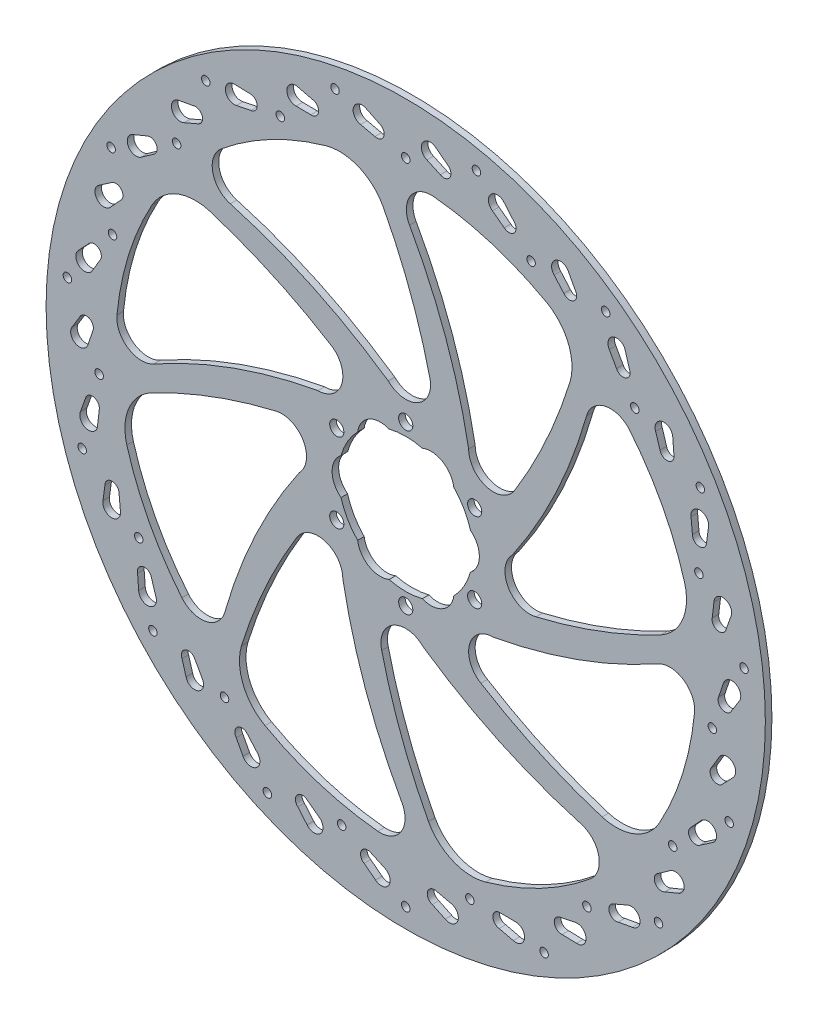
from build123d import *

# Parameters (mm, degrees)
SKETCH1_R      = 101.5
SKETCH1_R_2    = 1.2
SKETCH1_R_3    = 2
EXTRUDE1_DEPTH = 1.85


with BuildPart() as part:
    # Sketch1 → Extrude1 (new body)
    with BuildSketch(Plane.XY):
        Circle(SKETCH1_R)
        with Locations((-71.341909158, -64.236543533)):
            Circle(SKETCH1_R_2, mode=Mode.SUBTRACT)
        with Locations((-51.137316949, -70.384478511)):
            Circle(SKETCH1_R_2, mode=Mode.SUBTRACT)
        with BuildLine():
            Line((-61.998078989, -70.824326541), (-63.14297362, -66.91955058))
            ThreePointArc((-63.14297362, -66.91955058), (-62.141111955, -64.274503661), (-59.496065036, -65.276365326))
            Line((-59.496065036, -65.276365326), (-57.459092502, -68.897958465))
            ThreePointArc((-57.459092502, -68.897958465), (-58.475442576, -72.491803952), (-61.927280322, -71.06579237))
            ThreePointArc((-61.927280322, -71.06579237), (-61.965719597, -70.945950777), (-61.998078989, -70.824326541))
        make_face(mode=Mode.SUBTRACT)
        with BuildLine():
            Line((-75.368477695, -56.38651965), (-75.676505059, -52.329035434))
            ThreePointArc((-75.676505059, -52.329035434), (-74.146600298, -49.950087889), (-71.767652754, -51.47999265))
            Line((-71.767652754, -51.47999265), (-70.528164509, -55.445955693))
            ThreePointArc((-70.528164509, -55.445955693), (-72.269507387, -58.749955971), (-75.349429718, -56.637428741))
            ThreePointArc((-75.349429718, -56.637428741), (-75.362112534, -56.512214001), (-75.368477695, -56.38651965))
        make_face(mode=Mode.SUBTRACT)
        with Locations((-39.046720971, -87.700371201)):
            Circle(SKETCH1_R_2, mode=Mode.SUBTRACT)
        with BuildLine():
            Line((-45.918066731, -82.16677051), (-47.84979124, -78.585360251))
            ThreePointArc((-47.84979124, -78.585360251), (-47.419758833, -75.7898152), (-44.624213783, -76.219847607))
            Line((-44.624213783, -76.219847607), (-41.878782433, -79.338789842))
            ThreePointArc((-41.878782433, -79.338789842), (-42.125720327, -83.065412245), (-45.798611616, -82.38823986))
            ThreePointArc((-45.798611616, -82.38823986), (-45.861127369, -82.279009069), (-45.918066731, -82.16677051))
        make_face(mode=Mode.SUBTRACT)
        with BuildLine():
            Line((-27.831214617, -89.918132327), (-30.465343373, -86.816612584))
            ThreePointArc((-30.465343373, -86.816612584), (-30.625934705, -83.992748135), (-27.802070256, -83.832156804))
            Line((-27.802070256, -83.832156804), (-24.468168615, -86.312135394))
            ThreePointArc((-24.468168615, -86.312135394), (-23.934901959, -90.008663432), (-27.668323816, -90.109925926))
            ThreePointArc((-27.668323816, -90.109925926), (-27.752183808, -90.016079845), (-27.831214617, -89.918132327))
        make_face(mode=Mode.SUBTRACT)
        with Locations((0, -96.000007955)):
            Circle(SKETCH1_R_2, mode=Mode.SUBTRACT)
        with BuildLine():
            Line((-8.528004876, -93.739640287), (-11.749413813, -91.253562355))
            ThreePointArc((-11.749413813, -91.253562355), (-12.49361027, -88.524794935), (-9.764842851, -87.780598478))
            Line((-9.764842851, -87.780598478), (-5.988178417, -89.513226458))
            ThreePointArc((-5.988178417, -89.513226458), (-4.698013522, -93.018104117), (-8.328797499, -93.893375834))
            ThreePointArc((-8.328797499, -93.893375834), (-8.430336646, -93.819015988), (-8.528004876, -93.739640287))
        make_face(mode=Mode.SUBTRACT)
        with Locations((-18.088317101, -85.098841264)):
            Circle(SKETCH1_R_2, mode=Mode.SUBTRACT)
        with Locations((-91.30143313, -29.665633918)):
            Circle(SKETCH1_R_2, mode=Mode.SUBTRACT)
        with BuildLine():
            Line((-85.444912268, -39.484351277), (-84.902610092, -35.451490336))
            ThreePointArc((-84.902610092, -35.451490336), (-82.911526414, -33.442613588), (-80.902649666, -35.433697266))
            Line((-80.902649666, -35.433697266), (-80.514817296, -39.570698598))
            ThreePointArc((-80.514817296, -39.570698598), (-82.905047939, -42.440453001), (-85.478447469, -39.7337377))
            ThreePointArc((-85.478447469, -39.7337377), (-85.464819526, -39.608622296), (-85.444912268, -39.484351277))
        make_face(mode=Mode.SUBTRACT)
        with Locations((-75.344210129, -43.5)):
            Circle(SKETCH1_R_2, mode=Mode.SUBTRACT)
        with BuildLine():
            Line((-91.786994165, -20.856527287), (-90.418063655, -17.024544996))
            ThreePointArc((-90.418063655, -17.024544996), (-88.052820971, -15.473536599), (-86.501812575, -17.838779282))
            Line((-86.501812575, -17.838779282), (-86.982586214, -21.966012093))
            ThreePointArc((-86.982586214, -21.966012093), (-89.917240072, -24.276098583), (-91.871646894, -21.093491658))
            ThreePointArc((-91.871646894, -21.093491658), (-91.832303799, -20.973943734), (-91.786994165, -20.856527287))
        make_face(mode=Mode.SUBTRACT)
        with BuildLine():
            Line((-94.117543974, -1.317172973), (-91.981813962, 2.146454654))
            ThreePointArc((-91.981813962, 2.146454654), (-89.345784728, 3.17180819), (-88.320431192, 0.535778956))
            Line((-88.320431192, 0.535778956), (-89.648798725, -3.401305455))
            ThreePointArc((-89.648798725, -3.401305455), (-92.999617344, -5.050762167), (-94.2496145, -1.531358813))
            ThreePointArc((-94.2496145, -1.531358813), (-94.186275736, -1.422603187), (-94.117543974, -1.317172973))
        make_face(mode=Mode.SUBTRACT)
        with Locations((-86.523404897, -9.093976304)):
            Circle(SKETCH1_R_2, mode=Mode.SUBTRACT)
        with BuildLine():
            ThreePointArc((-51.044949255, -49.522858535), (-56.342570087, -54.471101417), (-63.183389209, -52.072541881))
            ThreePointArc((-63.183389209, -52.072541881), (-72.466897056, -38.108255286), (-78.710796809, -22.545526287))
            ThreePointArc((-78.710796809, -22.545526287), (-78.170211393, -13.29412178), (-71.969304687, -6.407215801))
            ThreePointArc((-71.969304687, -6.407215801), (-54.777609064, 1.292105638), (-36.75649861, 6.776039177))
            ThreePointArc((-36.75649861, 6.776039177), (-28.923584542, 3.475240148), (-30.050244577, -4.949749715))
            ThreePointArc((-30.050244577, -4.949749715), (-42.39020698, -26.368402936), (-51.044949255, -49.522858535))
        make_face(mode=Mode.SUBTRACT)
        with BuildLine():
            ThreePointArc((-30.782152671, -21.199386168), (-22.909428641, -17.99469689), (-17.748730128, -24.748733305))
            ThreePointArc((-17.748730128, -24.748733305), (-11.329126286, -48.619679336), (-1.07628067, -71.112178857))
            ThreePointArc((-1.07628067, -71.112178857), (-1.323328187, -78.357098569), (-7.85655549, -81.498250445))
            ThreePointArc((-7.85655549, -81.498250445), (-24.295228587, -78.188440052), (-39.714843653, -71.599032699))
            ThreePointArc((-39.714843653, -71.599032699), (-45.874322902, -64.675050223), (-46.359397641, -55.420569123))
            ThreePointArc((-46.359397641, -55.420569123), (-39.647275485, -37.819962167), (-30.782152671, -21.199386168))
        make_face(mode=Mode.SUBTRACT)
        with Locations((-19.459967777, -11.235217635)):
            Circle(SKETCH1_R_3, mode=Mode.SUBTRACT)
        with BuildLine():
            Line((11.1479196, -93.464276153), (7.480021511, -91.702293568))
            ThreePointArc((7.480021511, -91.702293568), (6.184744884, -89.187883407), (8.699155045, -87.892606779))
            Line((8.699155045, -87.892606779), (12.753523912, -88.802159994))
            ThreePointArc((12.753523912, -88.802159994), (14.744200648, -91.962207302), (11.374737236, -93.573234667))
            ThreePointArc((11.374737236, -93.573234667), (11.259956682, -93.521610938), (11.1479196, -93.464276153))
        make_face(mode=Mode.SUBTRACT)
        with Locations((18.088317101, -85.098841264)):
            Circle(SKETCH1_R_2, mode=Mode.SUBTRACT)
        with BuildLine():
            Line((30.336626496, -89.104074661), (26.382544002, -88.143194515))
            ThreePointArc((26.382544002, -88.143194515), (24.592797009, -85.953033403), (26.782958121, -84.16328641))
            Line((26.782958121, -84.16328641), (30.937836048, -84.210013017))
            ThreePointArc((30.937836048, -84.210013017), (33.5420225, -86.887120744), (30.581141371, -89.163494131))
            ThreePointArc((30.581141371, -89.163494131), (30.45813587, -89.136862723), (30.336626496, -89.104074661))
        make_face(mode=Mode.SUBTRACT)
        with Locations((39.046720971, -87.700371201)):
            Circle(SKETCH1_R_2, mode=Mode.SUBTRACT)
        with BuildLine():
            Line((48.199477243, -80.849597536), (44.132022723, -80.731814905))
            ThreePointArc((44.132022723, -80.731814905), (41.926025895, -78.961623391), (43.696217409, -76.755626563))
            Line((43.696217409, -76.755626563), (47.770016293, -75.937484388))
            ThreePointArc((47.770016293, -75.937484388), (50.873897017, -78.014650079), (48.451002884, -80.856881048))
            ThreePointArc((48.451002884, -80.856881048), (48.325148368, -80.856405882), (48.199477243, -80.849597536))
        make_face(mode=Mode.SUBTRACT)
        with BuildLine():
            ThreePointArc((-6.776039177, -36.756506565), (-3.475240148, -28.923592497), (4.949749715, -30.050252532))
            ThreePointArc((4.949749715, -30.050252532), (26.368402936, -42.390214935), (49.522858535, -51.04495721))
            ThreePointArc((49.522858535, -51.04495721), (54.471101417, -56.342578042), (52.072541881, -63.183397164))
            ThreePointArc((52.072541881, -63.183397164), (38.108255286, -72.466905011), (22.545526287, -78.710804764))
            ThreePointArc((22.545526287, -78.710804764), (13.29412178, -78.170219348), (6.4072158, -71.969312642))
            ThreePointArc((6.4072158, -71.969312642), (-1.292105638, -54.777617018), (-6.776039177, -36.756506565))
        make_face(mode=Mode.SUBTRACT)
        with Locations((51.137316949, -70.384478511)):
            Circle(SKETCH1_R_2, mode=Mode.SUBTRACT)
        with BuildLine():
            Line((63.955779547, -69.06160504), (59.952720281, -69.792067588))
            ThreePointArc((59.952720281, -69.792067588), (57.426886267, -68.519211537), (58.699742318, -65.993377522))
            Line((58.699742318, -65.993377522), (62.514417599, -64.346123302))
            ThreePointArc((62.514417599, -64.346123302), (65.982338113, -65.73256485), (64.203323077, -69.016434268))
            ThreePointArc((64.203323077, -69.016434268), (64.080119991, -69.042136111), (63.955779547, -69.06160504))
        make_face(mode=Mode.SUBTRACT)
        with Locations((71.341909157, -64.236543533)):
            Circle(SKETCH1_R_2, mode=Mode.SUBTRACT)
        with BuildLine():
            Line((76.916907392, -54.25528901), (73.153196279, -55.802072019))
            ThreePointArc((73.153196279, -55.802072019), (70.417916143, -55.082181347), (71.137806816, -52.346901211))
            Line((71.137806816, -52.346901211), (74.526638879, -49.94252786))
            ThreePointArc((74.526638879, -49.94252786), (78.207034416, -50.577651116), (77.14964997, -54.159638134))
            ThreePointArc((77.14964997, -54.159638134), (77.034482881, -54.210393691), (76.916907392, -54.25528901))
        make_face(mode=Mode.SUBTRACT)
        with Locations((0, -22.470435269)):
            Circle(SKETCH1_R_3, mode=Mode.SUBTRACT)
        with Locations((19.459967777, -11.235217635)):
            Circle(SKETCH1_R_3, mode=Mode.SUBTRACT)
        with BuildLine():
            ThreePointArc((71.599032699, -39.714843653), (64.675050223, -45.874322902), (55.420569123, -46.359397641))
            ThreePointArc((55.420569123, -46.359397641), (37.819962167, -39.647275485), (21.199386168, -30.782152671))
            ThreePointArc((21.199386168, -30.782152671), (17.99469689, -22.909428641), (24.748733305, -17.748730128))
            ThreePointArc((24.748733305, -17.748730128), (48.619679336, -11.329126286), (71.112178857, -1.07628067))
            ThreePointArc((71.112178857, -1.07628067), (78.357098569, -1.323328187), (81.498250445, -7.85655549))
            ThreePointArc((81.498250445, -7.85655549), (78.188440052, -24.295228587), (71.599032699, -39.714843653))
        make_face(mode=Mode.SUBTRACT)
        with Locations((75.344210129, -43.5)):
            Circle(SKETCH1_R_2, mode=Mode.SUBTRACT)
        with BuildLine():
            Line((86.516397295, -37.077756504), (83.156526571, -39.373258134))
            ThreePointArc((83.156526571, -39.373258134), (80.331345182, -39.237795518), (80.466807798, -36.41261413))
            Line((80.466807798, -36.41261413), (83.281688422, -33.356204301))
            ThreePointArc((83.281688422, -33.356204301), (87.013708036, -33.212251331), (86.724166954, -36.935805926))
            ThreePointArc((86.724166954, -36.935805926), (86.622069216, -37.009396937), (86.516397295, -37.077756504))
        make_face(mode=Mode.SUBTRACT)
        with Locations((91.30143313, -29.665633918)):
            Circle(SKETCH1_R_2, mode=Mode.SUBTRACT)
        with BuildLine():
            Line((92.334705485, -18.27974812), (89.525517622, -21.223643935))
            ThreePointArc((89.525517622, -21.223643935), (86.733908964, -21.678529742), (86.279023157, -18.886921083))
            Line((86.279023157, -18.886921083), (88.39692855, -15.312054553))
            ThreePointArc((88.39692855, -15.312054553), (92.017465076, -14.395316792), (92.508421694, -18.097701761))
            ThreePointArc((92.508421694, -18.097701761), (92.423855467, -18.190911946), (92.334705485, -18.27974812))
        make_face(mode=Mode.SUBTRACT)
        with Locations((86.523404897, -9.093976304)):
            Circle(SKETCH1_R_2, mode=Mode.SUBTRACT)
        with Locations((-95.474109867, 10.034733305)):
            Circle(SKETCH1_R_2, mode=Mode.SUBTRACT)
        with BuildLine():
            Line((-92.334705485, 18.27974812), (-89.525517622, 21.223643935))
            ThreePointArc((-89.525517622, 21.223643935), (-86.733908964, 21.678529742), (-86.279023157, 18.886921083))
            Line((-86.279023157, 18.886921083), (-88.39692855, 15.312054553))
            ThreePointArc((-88.39692855, 15.312054553), (-92.017465076, 14.395316792), (-92.508421694, 18.097701761))
            ThreePointArc((-92.508421694, 18.097701761), (-92.423855467, 18.190911946), (-92.334705485, 18.27974812))
        make_face(mode=Mode.SUBTRACT)
        with Locations((-82.741916918, 26.884478511)):
            Circle(SKETCH1_R_2, mode=Mode.SUBTRACT)
        with BuildLine():
            Line((-86.516397295, 37.077756504), (-83.156526571, 39.373258134))
            ThreePointArc((-83.156526571, 39.373258134), (-80.331345182, 39.237795518), (-80.466807798, 36.41261413))
            Line((-80.466807798, 36.41261413), (-83.281688422, 33.356204301))
            ThreePointArc((-83.281688422, 33.356204301), (-87.013708036, 33.212251331), (-86.724166954, 36.935805926))
            ThreePointArc((-86.724166954, 36.935805926), (-86.622069216, 37.009396937), (-86.516397295, 37.077756504))
        make_face(mode=Mode.SUBTRACT)
        with Locations((-83.138445652, 48.000003977)):
            Circle(SKETCH1_R_2, mode=Mode.SUBTRACT)
        with BuildLine():
            ThreePointArc((-71.599036677, 39.714839676), (-64.675054201, 45.874318924), (-55.4205731, 46.359393663))
            ThreePointArc((-55.4205731, 46.359393663), (-37.819966145, 39.647271507), (-21.199390146, 30.782148694))
            ThreePointArc((-21.199390146, 30.782148694), (-17.994700868, 22.909424663), (-24.748737282, 17.748726151))
            ThreePointArc((-24.748737282, 17.748726151), (-48.619683314, 11.329122309), (-71.112182835, 1.076276692))
            ThreePointArc((-71.112182835, 1.076276692), (-78.357102546, 1.32332421), (-81.498254423, 7.856551513))
            ThreePointArc((-81.498254423, 7.856551513), (-78.188444029, 24.29522461), (-71.599036677, 39.714839676))
        make_face(mode=Mode.SUBTRACT)
        with Locations((-19.459967777, 11.235217635)):
            Circle(SKETCH1_R_3, mode=Mode.SUBTRACT)
        with BuildLine():
            ThreePointArc((18.264129112, -5.126644885), (16.42850191, -9.485), (13.571869262, -13.253877347))
            ThreePointArc((13.571869262, -13.253877347), (10.388195629, -17.992882628), (4.69225985, -18.380522231))
            ThreePointArc((4.69225985, -18.380522231), (0, -18.97), (-4.69225985, -18.380522231))
            ThreePointArc((-4.69225985, -18.380522231), (-10.388195629, -17.992882628), (-13.571869262, -13.253877347))
            ThreePointArc((-13.571869262, -13.253877347), (-16.42850191, -9.485), (-18.264129112, -5.126644885))
            ThreePointArc((-18.264129112, -5.126644885), (-20.776391257, 0), (-18.264129112, 5.126644885))
            ThreePointArc((-18.264129112, 5.126644885), (-16.42850191, 9.485), (-13.571869262, 13.253877347))
            ThreePointArc((-13.571869262, 13.253877347), (-10.388195629, 17.992882628), (-4.69225985, 18.380522231))
            ThreePointArc((-4.69225985, 18.380522231), (0, 18.97), (4.69225985, 18.380522231))
            ThreePointArc((4.69225985, 18.380522231), (10.388195629, 17.992882628), (13.571869262, 13.253877347))
            ThreePointArc((13.571869262, 13.253877347), (16.42850191, 9.485), (18.264129112, 5.126644885))
            ThreePointArc((18.264129112, 5.126644885), (20.776391257, 0), (18.264129112, -5.126644885))
        make_face(mode=Mode.SUBTRACT)
        with BuildLine():
            Line((-76.916907392, 54.25528901), (-73.153196279, 55.802072019))
            ThreePointArc((-73.153196279, 55.802072019), (-70.417916143, 55.082181347), (-71.137806816, 52.346901211))
            Line((-71.137806816, 52.346901211), (-74.526638879, 49.94252786))
            ThreePointArc((-74.526638879, 49.94252786), (-78.207034416, 50.577651116), (-77.14964997, 54.159638134))
            ThreePointArc((-77.14964997, 54.159638134), (-77.034482881, 54.210393691), (-76.916907392, 54.25528901))
        make_face(mode=Mode.SUBTRACT)
        with Locations((-64.653599817, 58.214362753)):
            Circle(SKETCH1_R_2, mode=Mode.SUBTRACT)
        with BuildLine():
            Line((-63.955779547, 69.06160504), (-59.952720281, 69.792067588))
            ThreePointArc((-59.952720281, 69.792067588), (-57.426886267, 68.519211537), (-58.699742318, 65.993377522))
            Line((-58.699742318, 65.993377522), (-62.514417599, 64.346123302))
            ThreePointArc((-62.514417599, 64.346123302), (-65.982338113, 65.73256485), (-64.203323077, 69.016434268))
            ThreePointArc((-64.203323077, 69.016434268), (-64.080119991, 69.042136111), (-63.955779547, 69.06160504))
        make_face(mode=Mode.SUBTRACT)
        with Locations((-56.427388896, 77.665637896)):
            Circle(SKETCH1_R_2, mode=Mode.SUBTRACT)
        with BuildLine():
            ThreePointArc((-4.949749715, 30.050244577), (-26.368402936, 42.39020698), (-49.522858535, 51.044949255))
            ThreePointArc((-49.522858535, 51.044949255), (-54.471101417, 56.342570087), (-52.072541881, 63.183389209))
            ThreePointArc((-52.072541881, 63.183389209), (-38.108255286, 72.466897056), (-22.545526287, 78.710796809))
            ThreePointArc((-22.545526287, 78.710796809), (-13.29412178, 78.170211393), (-6.407215801, 71.969304687))
            ThreePointArc((-6.407215801, 71.969304687), (1.292105638, 54.777609064), (6.776039177, 36.75649861))
            ThreePointArc((6.776039177, 36.75649861), (3.475240148, 28.923584542), (-4.949749715, 30.050244577))
        make_face(mode=Mode.SUBTRACT)
        with BuildLine():
            Line((-48.199477243, 80.849597536), (-44.132022723, 80.731814905))
            ThreePointArc((-44.132022723, 80.731814905), (-41.926025895, 78.961623391), (-43.696217409, 76.755626563))
            Line((-43.696217409, 76.755626563), (-47.770016293, 75.937484388))
            ThreePointArc((-47.770016293, 75.937484388), (-50.873897017, 78.014650079), (-48.451002884, 80.856881048))
            ThreePointArc((-48.451002884, 80.856881048), (-48.325148368, 80.856405882), (-48.199477243, 80.849597536))
        make_face(mode=Mode.SUBTRACT)
        with Locations((-35.386087948, 79.478454815)):
            Circle(SKETCH1_R_2, mode=Mode.SUBTRACT)
        with BuildLine():
            Line((-30.336626496, 89.104074661), (-26.382544002, 88.143194515))
            ThreePointArc((-26.382544002, 88.143194515), (-24.592797009, 85.953033403), (-26.782958121, 84.16328641))
            Line((-26.782958121, 84.16328641), (-30.937836048, 84.210013017))
            ThreePointArc((-30.937836048, 84.210013017), (-33.5420225, 86.887120744), (-30.581141371, 89.163494131))
            ThreePointArc((-30.581141371, 89.163494131), (-30.45813587, 89.136862723), (-30.336626496, 89.104074661))
        make_face(mode=Mode.SUBTRACT)
        with Locations((-19.959523972, 93.902177452)):
            Circle(SKETCH1_R_2, mode=Mode.SUBTRACT)
        with BuildLine():
            Line((-11.1479196, 93.464276153), (-7.480021511, 91.702293568))
            ThreePointArc((-7.480021511, 91.702293568), (-6.184744884, 89.187883407), (-8.699155045, 87.892606779))
            Line((-8.699155045, 87.892606779), (-12.753523912, 88.802159994))
            ThreePointArc((-12.753523912, 88.802159994), (-14.744200648, 91.962207302), (-11.374737236, 93.573234667))
            ThreePointArc((-11.374737236, 93.573234667), (-11.259956682, 93.521610938), (-11.1479196, 93.464276153))
        make_face(mode=Mode.SUBTRACT)
        with Locations((19.459967777, 11.235217635)):
            Circle(SKETCH1_R_3, mode=Mode.SUBTRACT)
        with Locations((0, 22.470435269)):
            Circle(SKETCH1_R_3, mode=Mode.SUBTRACT)
        with BuildLine():
            ThreePointArc((30.782152671, 21.199386168), (22.909428641, 17.99469689), (17.748730128, 24.748733305))
            ThreePointArc((17.748730128, 24.748733305), (11.329126286, 48.619679336), (1.07628067, 71.112178857))
            ThreePointArc((1.07628067, 71.112178857), (1.323328187, 78.357098569), (7.85655549, 81.498250445))
            ThreePointArc((7.85655549, 81.498250445), (24.295228587, 78.188440052), (39.714843653, 71.599032699))
            ThreePointArc((39.714843653, 71.599032699), (45.874322902, 64.675050223), (46.359397641, 55.420569123))
            ThreePointArc((46.359397641, 55.420569123), (39.647275485, 37.819962167), (30.782152671, 21.199386168))
        make_face(mode=Mode.SUBTRACT)
        with BuildLine():
            ThreePointArc((63.183389209, 52.072541881), (72.466897056, 38.108255286), (78.710796809, 22.545526287))
            ThreePointArc((78.710796809, 22.545526287), (78.170211393, 13.29412178), (71.969304687, 6.407215801))
            ThreePointArc((71.969304687, 6.407215801), (54.777609064, -1.292105638), (36.75649861, -6.776039177))
            ThreePointArc((36.75649861, -6.776039177), (28.923584542, -3.475240148), (30.050244577, 4.949749715))
            ThreePointArc((30.050244577, 4.949749715), (42.39020698, 26.368402936), (51.044949255, 49.522858535))
            ThreePointArc((51.044949255, 49.522858535), (56.342570087, 54.471101417), (63.183389209, 52.072541881))
        make_face(mode=Mode.SUBTRACT)
        with BuildLine():
            Line((94.117543974, 1.317172973), (91.981813962, -2.146454654))
            ThreePointArc((91.981813962, -2.146454654), (89.345784728, -3.17180819), (88.320431192, -0.535778956))
            Line((88.320431192, -0.535778956), (89.648798725, 3.401305455))
            ThreePointArc((89.648798725, 3.401305455), (92.999617344, 5.050762167), (94.2496145, 1.531358813))
            ThreePointArc((94.2496145, 1.531358813), (94.186275736, 1.422603187), (94.117543974, 1.317172973))
        make_face(mode=Mode.SUBTRACT)
        with Locations((95.474109867, 10.034733305)):
            Circle(SKETCH1_R_2, mode=Mode.SUBTRACT)
        with BuildLine():
            Line((91.786994165, 20.856527287), (90.418063655, 17.024544996))
            ThreePointArc((90.418063655, 17.024544996), (88.052820971, 15.473536599), (86.501812575, 17.838779282))
            Line((86.501812575, 17.838779282), (86.982586214, 21.966012093))
            ThreePointArc((86.982586214, 21.966012093), (89.917240072, 24.276098583), (91.871646894, 21.093491658))
            ThreePointArc((91.871646894, 21.093491658), (91.832303799, 20.973943734), (91.786994165, 20.856527287))
        make_face(mode=Mode.SUBTRACT)
        with Locations((82.741916918, 26.884478511)):
            Circle(SKETCH1_R_2, mode=Mode.SUBTRACT)
        with BuildLine():
            Line((85.444912268, 39.484351277), (84.902610092, 35.451490336))
            ThreePointArc((84.902610092, 35.451490336), (82.911526414, 33.442613588), (80.902649666, 35.433697266))
            Line((80.902649666, 35.433697266), (80.514817296, 39.570698598))
            ThreePointArc((80.514817296, 39.570698598), (82.905047939, 42.440453001), (85.478447469, 39.7337377))
            ThreePointArc((85.478447469, 39.7337377), (85.464819526, 39.608622296), (85.444912268, 39.484351277))
        make_face(mode=Mode.SUBTRACT)
        with Locations((83.138445652, 48.000003977)):
            Circle(SKETCH1_R_2, mode=Mode.SUBTRACT)
        with Locations((0, 87)):
            Circle(SKETCH1_R_2, mode=Mode.SUBTRACT)
        with BuildLine():
            Line((8.528004876, 93.739640287), (11.749413813, 91.253562355))
            ThreePointArc((11.749413813, 91.253562355), (12.49361027, 88.524794935), (9.764842851, 87.780598478))
            Line((9.764842851, 87.780598478), (5.988178417, 89.513226458))
            ThreePointArc((5.988178417, 89.513226458), (4.698013522, 93.018104117), (8.328797499, 93.893375834))
            ThreePointArc((8.328797499, 93.893375834), (8.430336646, 93.819015988), (8.528004876, 93.739640287))
        make_face(mode=Mode.SUBTRACT)
        with Locations((19.959523972, 93.902177452)):
            Circle(SKETCH1_R_2, mode=Mode.SUBTRACT)
        with Locations((35.386087948, 79.478454815)):
            Circle(SKETCH1_R_2, mode=Mode.SUBTRACT)
        with BuildLine():
            Line((27.831214617, 89.918132327), (30.465343373, 86.816612584))
            ThreePointArc((30.465343373, 86.816612584), (30.625934705, 83.992748135), (27.802070256, 83.832156804))
            Line((27.802070256, 83.832156804), (24.468168615, 86.312135394))
            ThreePointArc((24.468168615, 86.312135394), (23.934901959, 90.008663432), (27.668323816, 90.109925926))
            ThreePointArc((27.668323816, 90.109925926), (27.752183808, 90.016079845), (27.831214617, 89.918132327))
        make_face(mode=Mode.SUBTRACT)
        with BuildLine():
            Line((45.918066731, 82.16677051), (47.84979124, 78.585360251))
            ThreePointArc((47.84979124, 78.585360251), (47.419758833, 75.7898152), (44.624213783, 76.219847607))
            Line((44.624213783, 76.219847607), (41.878782433, 79.338789842))
            ThreePointArc((41.878782433, 79.338789842), (42.125720327, 83.065412245), (45.798611616, 82.38823986))
            ThreePointArc((45.798611616, 82.38823986), (45.861127369, 82.279009069), (45.918066731, 82.16677051))
        make_face(mode=Mode.SUBTRACT)
        with BuildLine():
            Line((75.368477695, 56.38651965), (75.676505059, 52.329035434))
            ThreePointArc((75.676505059, 52.329035434), (74.146600298, 49.950087889), (71.767652754, 51.47999265))
            Line((71.767652754, 51.47999265), (70.528164509, 55.445955693))
            ThreePointArc((70.528164509, 55.445955693), (72.269507387, 58.749955971), (75.349429718, 56.637428741))
            ThreePointArc((75.349429718, 56.637428741), (75.362112534, 56.512214001), (75.368477695, 56.38651965))
        make_face(mode=Mode.SUBTRACT)
        with Locations((64.653599817, 58.214362753)):
            Circle(SKETCH1_R_2, mode=Mode.SUBTRACT)
        with BuildLine():
            Line((61.998078989, 70.824326541), (63.14297362, 66.91955058))
            ThreePointArc((63.14297362, 66.91955058), (62.141111955, 64.274503661), (59.496065036, 65.276365326))
            Line((59.496065036, 65.276365326), (57.459092502, 68.897958465))
            ThreePointArc((57.459092502, 68.897958465), (58.475442576, 72.491803952), (61.927280322, 71.06579237))
            ThreePointArc((61.927280322, 71.06579237), (61.965719597, 70.945950777), (61.998078989, 70.824326541))
        make_face(mode=Mode.SUBTRACT)
        with Locations((56.427388896, 77.665637896)):
            Circle(SKETCH1_R_2, mode=Mode.SUBTRACT)
    extrude(amount=EXTRUDE1_DEPTH)


solid = part.part
